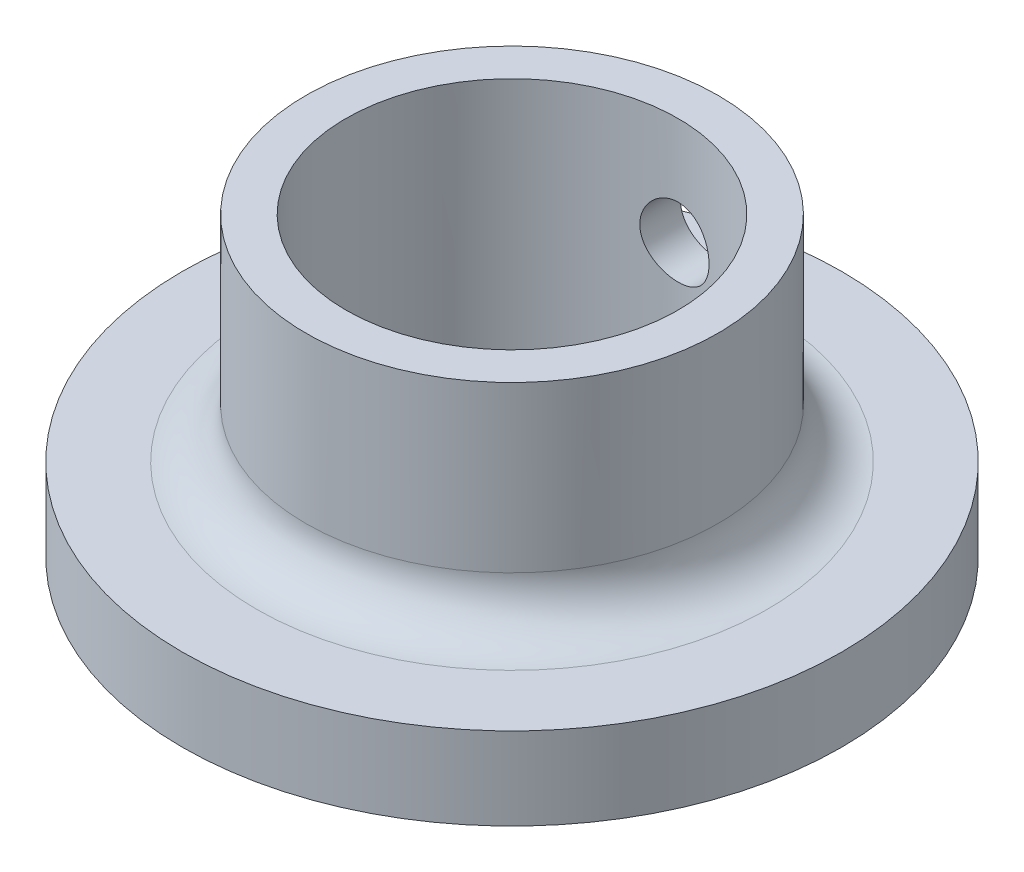
from build123d import *

# Parameters (mm, degrees)
SKIZZE3_R                       = 10.075
SCHNITT_LINEAR_AUSTRAGEN1_DEPTH = 34.526109228
SKIZZE4_R                       = 2.1
SCHNITT_LINEAR_AUSTRAGEN2_DEPTH = 34.526109228
VERRUNDUNG1_R                   = 3
FASE1_SIZE                      = 2


with BuildPart() as part:
    # Skizze2 → Rotation1 (revolve)
    with BuildSketch(Plane.XY, mode=Mode.PRIVATE) as rotation1_sk:
        Polygon((0, 0), (20, 0), (20, 5), (12.5, 5), (12.5, 18), (0, 18), align=None)
    revolve(rotation1_sk.sketch.rotate(Axis((0, 0, 0), (0, 1, 0)), 90), axis=Axis((0, 0, 0), (0, 1, 0)))

    # Skizze3 → Schnitt-Linear austragen1 (cut, through all)
    with BuildSketch(Plane(origin=(0, 18, 0), x_dir=(1, 0, 0), z_dir=(0, 1, 0))):
        with Locations(Location((0, 0, 0), (0, 0, 270))):
            Circle(SKIZZE3_R)
    extrude(amount=-SCHNITT_LINEAR_AUSTRAGEN1_DEPTH, mode=Mode.SUBTRACT)

    # Skizze4 → Schnitt-Linear austragen2 (cut, through all)
    with BuildSketch(Plane.XY):
        with Locations((0, 11.5)):
            Circle(SKIZZE4_R)
    extrude(amount=-SCHNITT_LINEAR_AUSTRAGEN2_DEPTH, mode=Mode.SUBTRACT)

    # Verrundung1
    verrundung1_edges = [part.edges().sort_by_distance(p)[0] for p in [
        (0, 5, 12.5),
    ]]
    fillet(verrundung1_edges, radius=VERRUNDUNG1_R)

    # Fase1
    fase1_edges = [part.edges().sort_by_distance(p)[0] for p in [
        (0, 0, -10.075),
    ]]
    chamfer(fase1_edges, length=FASE1_SIZE)


solid = part.part
